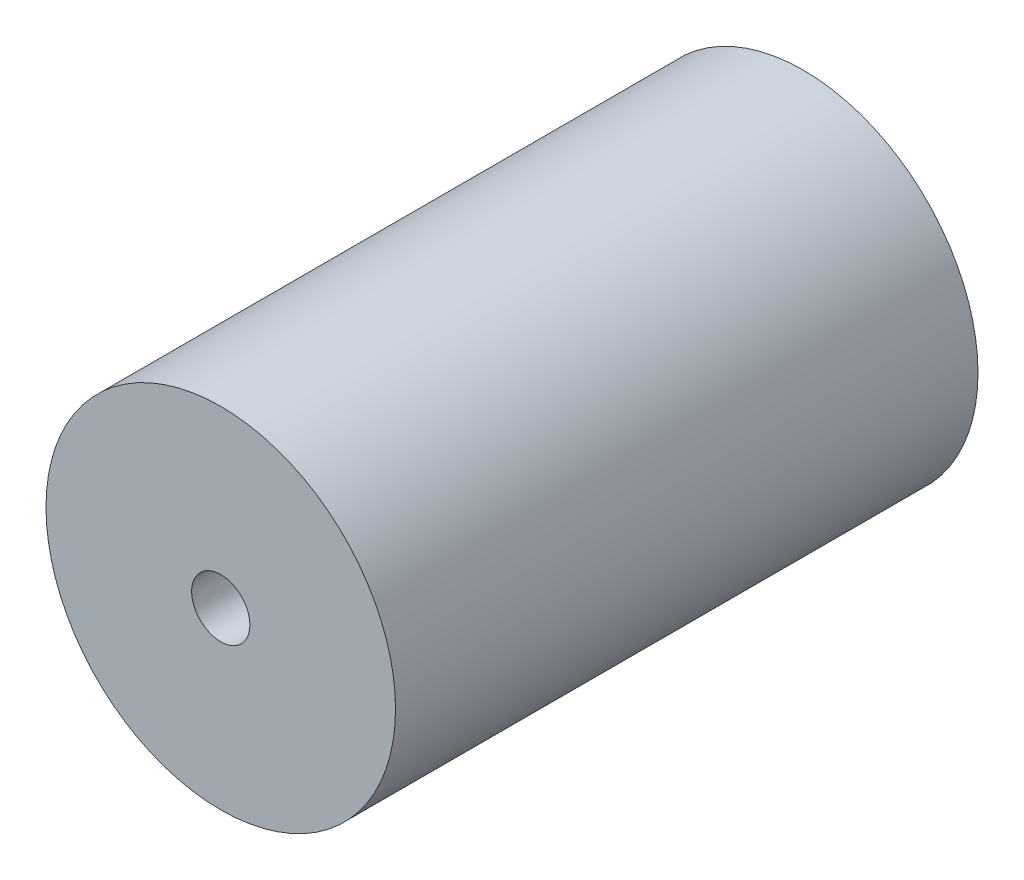
from build123d import *

# Parameters (mm, degrees)
BOSS_EXTRUDE1_DEPTH      = 30
BOSS_EXTRUDE1_DEPTH_BACK = 30
SKETCH2_R                = 18
SKETCH3_R                = 3
CUT_EXTRUDE1_DEPTH       = 60


with BuildPart() as part:
    # Sketch2 → Boss-Extrude1 (new, two sides: drawn at the far end of the back side and taken through both)
    with BuildSketch(Plane.XY.offset(-BOSS_EXTRUDE1_DEPTH_BACK)):
        Circle(SKETCH2_R)
    extrude(amount=BOSS_EXTRUDE1_DEPTH + BOSS_EXTRUDE1_DEPTH_BACK)

    # Sketch3 → Cut-Extrude1 (cut)
    with BuildSketch(Plane.XY.offset(30)):
        Circle(SKETCH3_R)
    extrude(amount=-CUT_EXTRUDE1_DEPTH, mode=Mode.SUBTRACT)


solid = part.part
